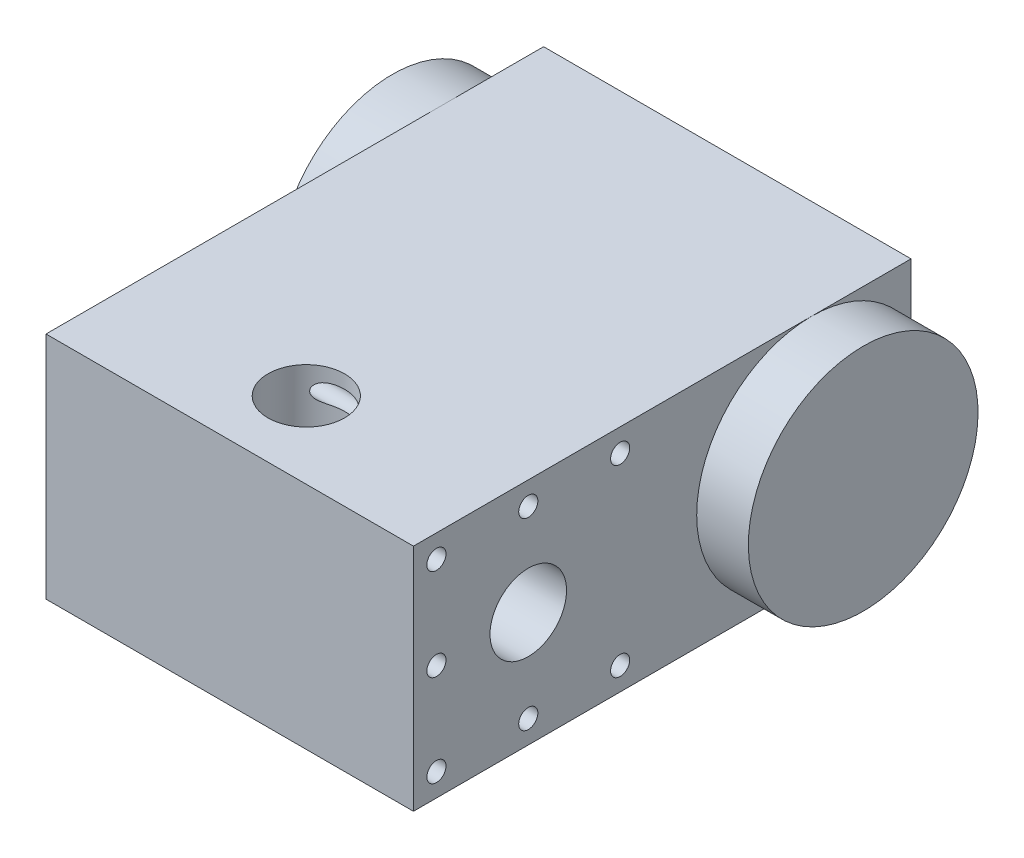
from build123d import *

# Parameters (mm, degrees)
SKETCH_1_W          = 48
SKETCH_1_H          = 30
EXTRUDE_1_DEPTH     = 65
SKETCH_2_R          = 15
EXTRUDE_2_DEPTH     = 6.75
EXTRUDE_START       = 6.75
SKETCH_3_R          = 15
EXTRUDE_3_DEPTH     = 6.75
SKETCH_4_R          = 1.25
SKETCH_4_R_2        = 5
CUT_EXTRUDE_1_DEPTH = 87.299261295
SKETCH_5_R          = 5
CUT_EXTRUDE_2_DEPTH = 33
SKETCH_6_R          = 5
EXTRUDE_4_DEPTH     = 10


with BuildPart() as part:
    # 草图1 → 凸台-拉伸1 (new body)
    with BuildSketch(Plane.XY):
        Rectangle(SKETCH_1_W, SKETCH_1_H)
    extrude(amount=EXTRUDE_1_DEPTH)

    # 草图2 → 凸台-拉伸2 (add)
    with BuildSketch(Plane.ZY.offset(24)):
        with Locations(Location((13, 0, 0), (0, 0, 270))):
            Circle(SKETCH_2_R)
    extrude(amount=EXTRUDE_2_DEPTH)

    # 草图3 → 凸台-拉伸3 (add)
    with BuildSketch(Plane(origin=(24, 0, 0), x_dir=(0, 0, -1), z_dir=(1, 0, 0)).offset(EXTRUDE_START)):
        with Locations(Location((-13, 0, 0), (0, 0, 270))):
            Circle(SKETCH_3_R)
    extrude(amount=-EXTRUDE_3_DEPTH)

    # 草图4 → 切除-拉伸1 (cut, through all)
    with BuildSketch(Plane(origin=(24, 0, 0), x_dir=(0, 0, -1), z_dir=(1, 0, 0))):
        with Locations(Location((-62, 12, 0), (0, 0, 90))):
            Circle(SKETCH_4_R)
        with Locations(Location((-38, 12, 0), (0, 0, 90))):
            Circle(SKETCH_4_R)
        with Locations(Location((-38, -12, 0), (0, 0, 90))):
            Circle(SKETCH_4_R)
        with Locations(Location((-62, -12, 0), (0, 0, 90))):
            Circle(SKETCH_4_R)
        with Locations(Location((-50, 12, 0), (0, 0, 90))):
            Circle(SKETCH_4_R)
        with Locations(Location((-50, -12, 0), (0, 0, 90))):
            Circle(SKETCH_4_R)
        with Locations(Location((-62, 0, 0), (0, 0, 90))):
            Circle(SKETCH_4_R)
        with Locations(Location((-50, 0, 0), (0, 0, 90))):
            Circle(SKETCH_4_R_2)
    extrude(amount=-CUT_EXTRUDE_1_DEPTH, mode=Mode.SUBTRACT)

    # 草图5 → 切除-拉伸2 (cut)
    with BuildSketch(Plane.XZ.offset(15)):
        with Locations((0, 55)):
            Circle(SKETCH_5_R)
    extrude(amount=-CUT_EXTRUDE_2_DEPTH, mode=Mode.SUBTRACT)

    # 草图6 → 凸台-拉伸4 (add)
    with BuildSketch(Plane.XY.offset(65)):
        Circle(SKETCH_6_R)
    extrude(amount=-EXTRUDE_4_DEPTH)


solid = part.part
